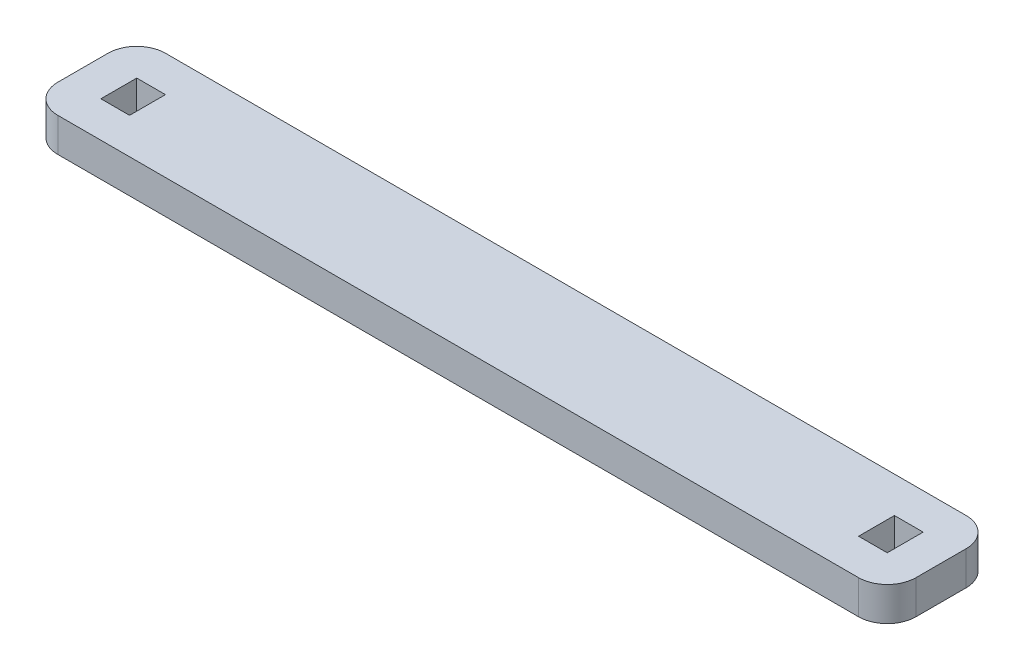
from build123d import *

# Parameters (mm, degrees)
SKETCH1_W           = 75.946
SKETCH1_H           = 9.525
SKETCH1_W_2         = 2.54
SKETCH1_H_2         = 3.175
BOSS_EXTRUDE1_DEPTH = 1.5
FILLET1_R           = 2.54


with BuildPart() as part:
    # Sketch1 → Boss-Extrude1 (new, symmetric)
    with BuildSketch(Plane(origin=(0, 0, 0), x_dir=(1, 0, 0), z_dir=(0, 1, 0))):
        Rectangle(SKETCH1_W, SKETCH1_H)
        with Locations((-33.528, 0)):
            Rectangle(SKETCH1_W_2, SKETCH1_H_2, mode=Mode.SUBTRACT)
        with Locations((33.528, 0)):
            Rectangle(SKETCH1_W_2, SKETCH1_H_2, mode=Mode.SUBTRACT)
    extrude(amount=BOSS_EXTRUDE1_DEPTH, both=True)

    # Fillet1
    fillet1_edges = [part.edges().sort_by_distance(p)[0] for p in [
        (-37.973, 0, -4.7625),
        (37.973, 0, -4.7625),
        (37.973, 0, 4.7625),
        (-37.973, 0, 4.7625),
    ]]
    fillet(fillet1_edges, radius=FILLET1_R)


solid = part.part
